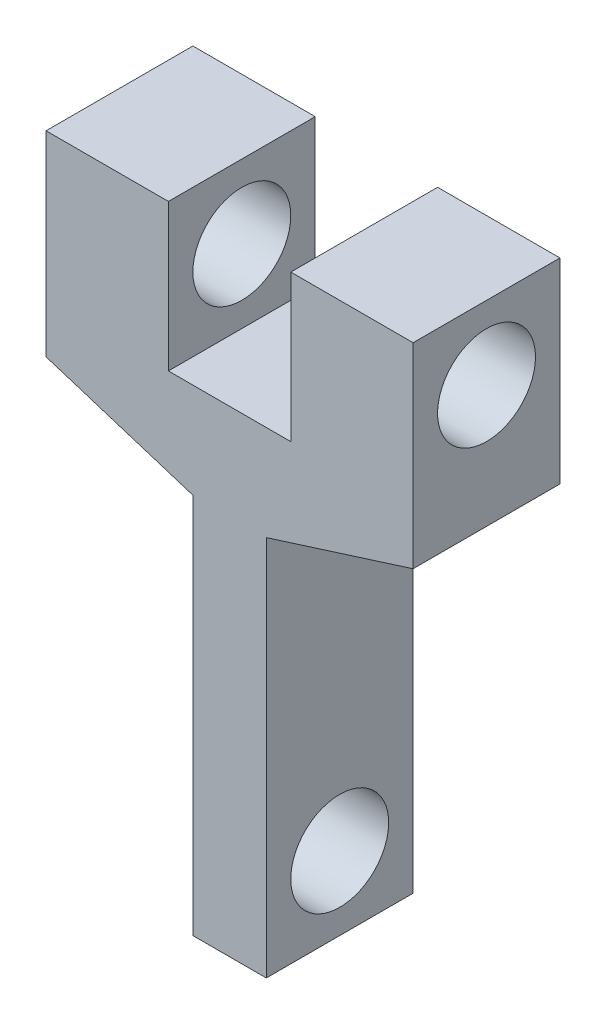
from build123d import *

# Parameters (mm, degrees)
BOSS_EXTRU_1_DEPTH      = 6
ENL_V_MAT_EXTRU_1_REACH = 24.556
ESQUISSE2_R             = 2
ESQUISSE3_R             = 2
ENL_V_MAT_EXTRU_2_DEPTH = 3


with BuildPart() as part:
    # Esquisse1 → Boss.-Extru.1 (new body)
    with BuildSketch(Plane.XY):
        Polygon((-7.5, 7.741189715), (-1.5, 5.844713829), (-1.5, -9.741189715), (1.5, -9.741189715), (1.5, 5.844713829), (7.5, 7.741189715), (7.5, 15.741189715), (2.5, 15.741189715), (2.5, 9.741189715), (-2.5, 9.741189715), (-2.5, 15.741189715), (-7.5, 15.741189715), align=None)
    extrude(amount=BOSS_EXTRU_1_DEPTH)

    # Enlèv. mat.-Extru.1: up to this face of the body (flat: up to its plane)
    enl_v_mat_extru_1_end = Plane(part.part.faces().sort_by_distance((-7.5, 11.741189715, 3))[0])
    # Esquisse2 → Enlèv. mat.-Extru.1 (cut, up to the picked face)
    with BuildSketch(Plane(origin=(7.5, 0, 0), x_dir=(0, 0, -1), z_dir=(1, 0, 0)), mode=Mode.PRIVATE) as enl_v_mat_extru_1_sk1:
        with Locations((-3, 12.741189715)):
            Circle(ESQUISSE2_R)
    enl_v_mat_extru_1_tool1 = split(extrude(enl_v_mat_extru_1_sk1.sketch, amount=-ENL_V_MAT_EXTRU_1_REACH, mode=Mode.PRIVATE), bisect_by=enl_v_mat_extru_1_end, keep=Keep.BOTH, mode=Mode.PRIVATE)
    add(enl_v_mat_extru_1_tool1.solids().sort_by(Axis((7.5, 12.74119, 3), (-1, 0, 0)))[0], mode=Mode.SUBTRACT)

    # Esquisse3 → Enlèv. mat.-Extru.2 (cut)
    with BuildSketch(Plane(origin=(1.5, 0, 0), x_dir=(0, 0, -1), z_dir=(1, 0, 0))):
        with Locations(Location((-3, -6.741189715, 0), (0, 0, 90))):
            Circle(ESQUISSE3_R)
    extrude(amount=-ENL_V_MAT_EXTRU_2_DEPTH, mode=Mode.SUBTRACT)


solid = part.part
